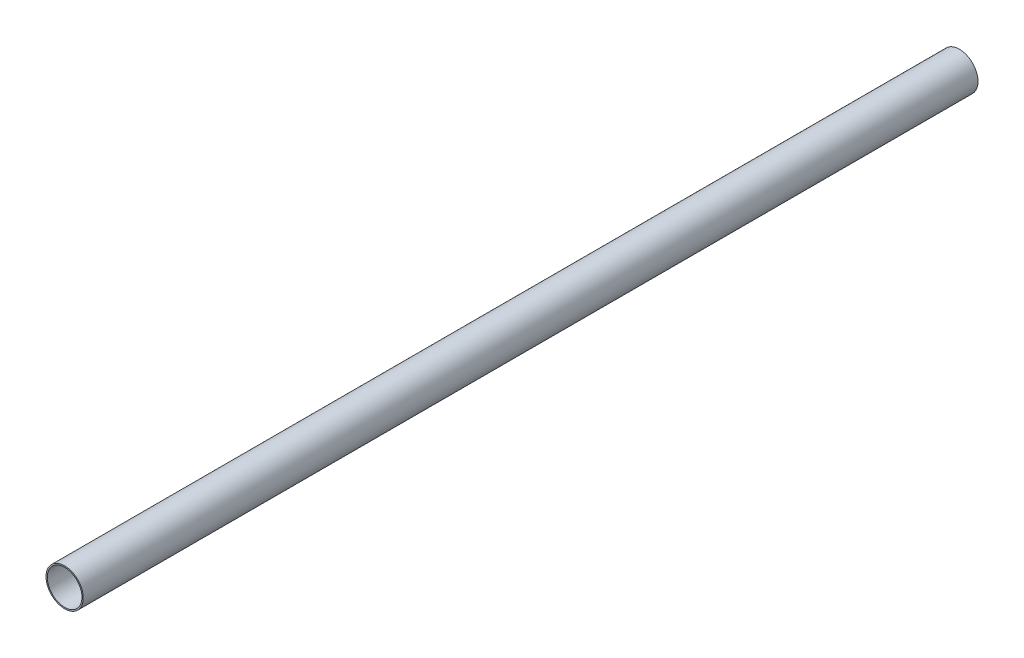
from build123d import *

# Parameters (mm, degrees)
SKETCH3_R           = 12.7
SKETCH3_R_2         = 11.811
BOSS_EXTRUDE1_DEPTH = 304.8


with BuildPart() as part:
    # Sketch3 → Boss-Extrude1 (new, symmetric)
    with BuildSketch(Plane.XY):
        with Locations(Location((0, 0, 0), (0, 0, 180))):
            Circle(SKETCH3_R)
        with Locations(Location((0, 0, 0), (0, 0, 180))):
            Circle(SKETCH3_R_2, mode=Mode.SUBTRACT)
    extrude(amount=BOSS_EXTRUDE1_DEPTH, both=True)


solid = part.part
